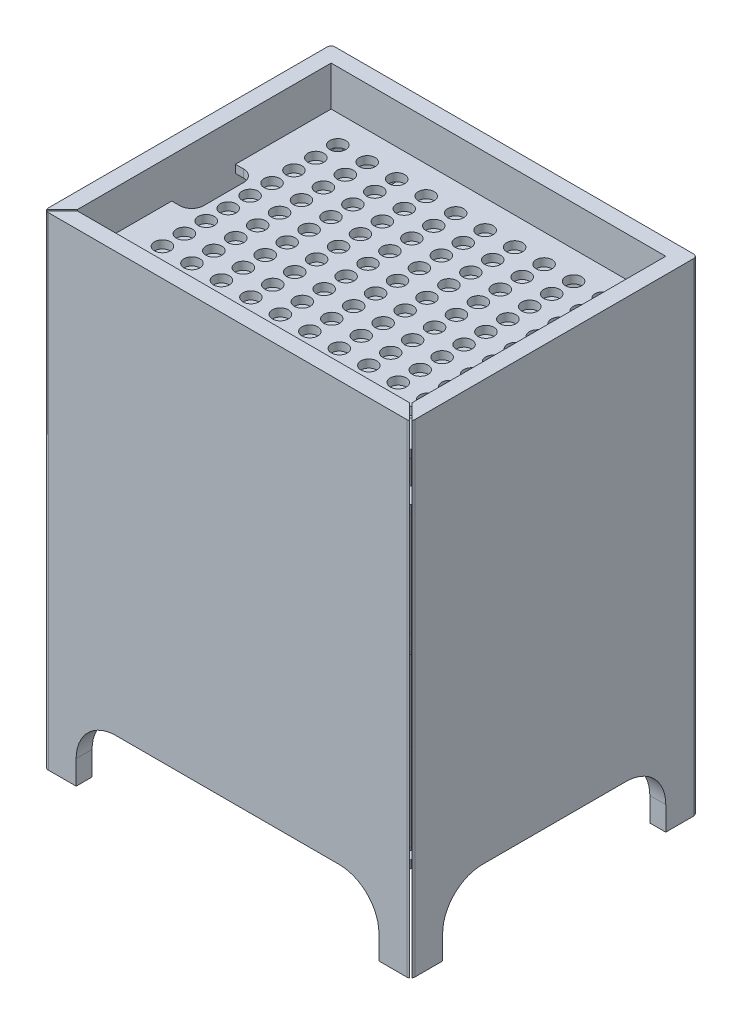
from build123d import *

# Parameters (mm, degrees)
SKETCH2_W                 = 420
SKETCH2_H                 = 320
BOSS_EXTRUDE1_DEPTH       = 10
SKETCH6_W                 = 400
SKETCH6_H                 = 300
BOSS_EXTRUDE4_DEPTH       = 3
SKETCH4_W                 = 400
SKETCH4_H                 = 300
BOSS_EXTRUDE2_DEPTH       = 110
SKETCH5_W                 = 400
SKETCH5_H                 = 300
BOSS_EXTRUDE3_DEPTH       = 110
SKETCH7_W                 = 420
SKETCH7_H                 = 320
SKETCH7_W_2               = 360
SKETCH7_H_2               = 260
BOSS_EXTRUDE5_DEPTH       = 3
SKETCH8_W                 = 420
SKETCH8_H                 = 320
SKETCH8_W_2               = 380
SKETCH8_H_2               = 280
BOSS_EXTRUDE6_DEPTH       = 20
SKETCH9_W                 = 390
SKETCH9_H                 = 290
SKETCH9_R                 = 110
BOSS_EXTRUDE7_DEPTH       = 10
SKETCH10_W                = 420
SKETCH10_H                = 320
SKETCH10_W_2              = 390
SKETCH10_H_2              = 290
BOSS_EXTRUDE8_DEPTH       = 130
SKETCH11_W                = 420
SKETCH11_H                = 320
SKETCH11_R                = 110
BOSS_EXTRUDE9_DEPTH       = 10
SKETCH12_W                = 100
SKETCH12_H                = 15
SKETCH12_W_2              = 15
SKETCH12_H_2              = 100
BOSS_EXTRUDE10_DEPTH      = 50
SKETCH13_W                = 420
SKETCH13_H                = 320
BOSS_EXTRUDE11_DEPTH      = 10
SKETCH14_R                = 10
CUT_EXTRUDE1_DEPTH        = 10
CUT_EXTRUDE2_DEPTH        = 10
BOSS_EXTRUDE12_DEPTH      = 2
BOSS_EXTRUDE14_DEPTH      = 50
BOSS_EXTRUDE14_DEPTH_BACK = 556
SKETCH18_W                = 460
SKETCH18_H                = 360
SKETCH18_W_2              = 420
SKETCH18_H_2              = 320
CUT_EXTRUDE3_DEPTH        = 732.939888242
CUT_EXTRUDE3_DEPTH_BACK   = 50
CUT_EXTRUDE4_DEPTH        = 771.218150916
CUT_EXTRUDE4_DEPTH_BACK   = 50
FILLET1_R                 = 5
CUT_EXTRUDE5_START        = -606
CUT_EXTRUDE5_DEPTH        = 606


with BuildPart() as part:
    # Sketch2 → Boss-Extrude1 (new body)
    with BuildSketch(Plane(origin=(0, 100, 0), x_dir=(1, 0, 0), z_dir=(0, 1, 0))):
        Rectangle(SKETCH2_W, SKETCH2_H)
        with BuildLine():
            Line((180, -105), (180, 105))
            ThreePointArc((180, 105), (172.67766953, 122.67766953), (155, 130))
            Line((155, 130), (-155, 130))
            ThreePointArc((-155, 130), (-172.67766953, 122.67766953), (-180, 105))
            Line((-180, 105), (-180, -105))
            ThreePointArc((-180, -105), (-172.67766953, -122.67766953), (-155, -130))
            Line((-155, -130), (155, -130))
            ThreePointArc((155, -130), (172.67766953, -122.67766953), (180, -105))
        make_face(mode=Mode.SUBTRACT)
    extrude(amount=BOSS_EXTRUDE1_DEPTH)


with BuildPart() as body_2:
    # Sketch6 → Boss-Extrude4 (new body)
    with BuildSketch(Plane(origin=(0, 110, 0), x_dir=(1, 0, 0), z_dir=(0, 1, 0))):
        Rectangle(SKETCH6_W, SKETCH6_H)
    extrude(amount=BOSS_EXTRUDE4_DEPTH)


with BuildPart() as body_3:
    # Sketch4 → Boss-Extrude2 (new body)
    with BuildSketch(Plane(origin=(0, 113, 0), x_dir=(1, 0, 0), z_dir=(0, 1, 0))):
        Rectangle(SKETCH4_W, SKETCH4_H)
    extrude(amount=BOSS_EXTRUDE2_DEPTH)


with BuildPart() as body_4:
    # Sketch5 → Boss-Extrude3 (new body)
    with BuildSketch(Plane(origin=(0, 223, 0), x_dir=(1, 0, 0), z_dir=(0, 1, 0))):
        Rectangle(SKETCH5_W, SKETCH5_H)
    extrude(amount=BOSS_EXTRUDE3_DEPTH)


with BuildPart() as body_5:
    # Sketch7 → Boss-Extrude5 (new body)
    with BuildSketch(Plane(origin=(0, 333, 0), x_dir=(1, 0, 0), z_dir=(0, 1, 0))):
        Rectangle(SKETCH7_W, SKETCH7_H)
        Rectangle(SKETCH7_W_2, SKETCH7_H_2, mode=Mode.SUBTRACT)
    extrude(amount=BOSS_EXTRUDE5_DEPTH)


with BuildPart() as body_6:
    # Sketch8 → Boss-Extrude6 (new body)
    with BuildSketch(Plane(origin=(0, 336, 0), x_dir=(1, 0, 0), z_dir=(0, 1, 0))):
        Rectangle(SKETCH8_W, SKETCH8_H)
        Rectangle(SKETCH8_W_2, SKETCH8_H_2, mode=Mode.SUBTRACT)
    extrude(amount=BOSS_EXTRUDE6_DEPTH)


with BuildPart() as body_7:
    # Sketch9 → Boss-Extrude7 (new body)
    with BuildSketch(Plane(origin=(0, 356, 0), x_dir=(1, 0, 0), z_dir=(0, 1, 0))):
        Rectangle(SKETCH9_W, SKETCH9_H)
        with Locations(Location((0, 0, 0), (0, 0, 270))):
            Circle(SKETCH9_R, mode=Mode.SUBTRACT)
    extrude(amount=BOSS_EXTRUDE7_DEPTH)


with BuildPart() as body_8:
    # Sketch10 → Boss-Extrude8 (new body)
    with BuildSketch(Plane(origin=(0, 356, 0), x_dir=(1, 0, 0), z_dir=(0, 1, 0))):
        Rectangle(SKETCH10_W, SKETCH10_H)
        Rectangle(SKETCH10_W_2, SKETCH10_H_2, mode=Mode.SUBTRACT)
    extrude(amount=BOSS_EXTRUDE8_DEPTH)


with BuildPart() as body_9:
    # Sketch11 → Boss-Extrude9 (new body)
    with BuildSketch(Plane(origin=(0, 486, 0), x_dir=(1, 0, 0), z_dir=(0, 1, 0))):
        Rectangle(SKETCH11_W, SKETCH11_H)
        with Locations(Location((0, 0, 0), (0, 0, 270))):
            Circle(SKETCH11_R, mode=Mode.SUBTRACT)
    extrude(amount=BOSS_EXTRUDE9_DEPTH)


with BuildPart() as body_10:
    # Sketch12 → Boss-Extrude10 (new body)
    with BuildSketch(Plane(origin=(0, 496, 0), x_dir=(1, 0, 0), z_dir=(0, 1, 0))):
        with Locations((-50, 132.5)):
            Rectangle(SKETCH12_W, SKETCH12_H)
        with Locations((50, 132.5)):
            Rectangle(SKETCH12_W, SKETCH12_H)
        with Locations((182.5, 90)):
            Rectangle(SKETCH12_W_2, SKETCH12_H_2)
        with Locations((182.5, -90)):
            Rectangle(SKETCH12_W_2, SKETCH12_H_2)
        with Locations((50, -132.5)):
            Rectangle(SKETCH12_W, SKETCH12_H)
        with Locations((-50, -132.5)):
            Rectangle(SKETCH12_W, SKETCH12_H)
        with Locations((-182.5, -90)):
            Rectangle(SKETCH12_W_2, SKETCH12_H_2)
        with Locations((-182.5, 90)):
            Rectangle(SKETCH12_W_2, SKETCH12_H_2)
    extrude(amount=BOSS_EXTRUDE10_DEPTH)


with BuildPart() as body_11:
    # Sketch13 → Boss-Extrude11 (new body)
    with BuildSketch(Plane(origin=(0, 546, 0), x_dir=(1, 0, 0), z_dir=(0, 1, 0))):
        Rectangle(SKETCH13_W, SKETCH13_H)
    extrude(amount=BOSS_EXTRUDE11_DEPTH)

    # Sketch14 → Cut-Extrude1 (cut)
    with BuildSketch(Plane(origin=(0, 556, 0), x_dir=(1, 0, 0), z_dir=(0, 1, 0))):
        with Locations(Location((-166.666666667, 125, 0), (0, 0, 270))):
            Circle(SKETCH14_R)
        with Locations(Location((-129.666666667, 125, 0), (0, 0, 270))):
            Circle(SKETCH14_R)
        with Locations(Location((-92.666666667, 125, 0), (0, 0, 270))):
            Circle(SKETCH14_R)
        with Locations(Location((-55.666666667, 125, 0), (0, 0, 270))):
            Circle(SKETCH14_R)
        with Locations(Location((-18.666666667, 125, 0), (0, 0, 270))):
            Circle(SKETCH14_R)
        with Locations(Location((18.333333333, 125, 0), (0, 0, 270))):
            Circle(SKETCH14_R)
        with Locations(Location((55.333333333, 125, 0), (0, 0, 270))):
            Circle(SKETCH14_R)
        with Locations(Location((92.333333333, 125, 0), (0, 0, 270))):
            Circle(SKETCH14_R)
        with Locations(Location((129.333333333, 125, 0), (0, 0, 270))):
            Circle(SKETCH14_R)
        with Locations(Location((166.333333333, 125, 0), (0, 0, 270))):
            Circle(SKETCH14_R)
        with Locations(Location((-166.666666667, 97.5, 0), (0, 0, 270))):
            Circle(SKETCH14_R)
        with Locations(Location((-129.666666667, 97.5, 0), (0, 0, 270))):
            Circle(SKETCH14_R)
        with Locations(Location((-92.666666667, 97.5, 0), (0, 0, 270))):
            Circle(SKETCH14_R)
        with Locations(Location((-55.666666667, 97.5, 0), (0, 0, 270))):
            Circle(SKETCH14_R)
        with Locations(Location((-18.666666667, 97.5, 0), (0, 0, 270))):
            Circle(SKETCH14_R)
        with Locations(Location((18.333333333, 97.5, 0), (0, 0, 270))):
            Circle(SKETCH14_R)
        with Locations(Location((55.333333333, 97.5, 0), (0, 0, 270))):
            Circle(SKETCH14_R)
        with Locations(Location((92.333333333, 97.5, 0), (0, 0, 270))):
            Circle(SKETCH14_R)
        with Locations(Location((129.333333333, 97.5, 0), (0, 0, 270))):
            Circle(SKETCH14_R)
        with Locations(Location((166.333333333, 97.5, 0), (0, 0, 270))):
            Circle(SKETCH14_R)
        with Locations(Location((-166.666666667, 70, 0), (0, 0, 270))):
            Circle(SKETCH14_R)
        with Locations(Location((-129.666666667, 70, 0), (0, 0, 270))):
            Circle(SKETCH14_R)
        with Locations(Location((-92.666666667, 70, 0), (0, 0, 270))):
            Circle(SKETCH14_R)
        with Locations(Location((-55.666666667, 70, 0), (0, 0, 270))):
            Circle(SKETCH14_R)
        with Locations(Location((-18.666666667, 70, 0), (0, 0, 270))):
            Circle(SKETCH14_R)
        with Locations(Location((18.333333333, 70, 0), (0, 0, 270))):
            Circle(SKETCH14_R)
        with Locations(Location((55.333333333, 70, 0), (0, 0, 270))):
            Circle(SKETCH14_R)
        with Locations(Location((92.333333333, 70, 0), (0, 0, 270))):
            Circle(SKETCH14_R)
        with Locations(Location((129.333333333, 70, 0), (0, 0, 270))):
            Circle(SKETCH14_R)
        with Locations(Location((166.333333333, 70, 0), (0, 0, 270))):
            Circle(SKETCH14_R)
        with Locations(Location((-166.666666667, 42.5, 0), (0, 0, 270))):
            Circle(SKETCH14_R)
        with Locations(Location((-129.666666667, 42.5, 0), (0, 0, 270))):
            Circle(SKETCH14_R)
        with Locations(Location((-92.666666667, 42.5, 0), (0, 0, 270))):
            Circle(SKETCH14_R)
        with Locations(Location((-55.666666667, 42.5, 0), (0, 0, 270))):
            Circle(SKETCH14_R)
        with Locations(Location((-18.666666667, 42.5, 0), (0, 0, 270))):
            Circle(SKETCH14_R)
        with Locations(Location((18.333333333, 42.5, 0), (0, 0, 270))):
            Circle(SKETCH14_R)
        with Locations(Location((55.333333333, 42.5, 0), (0, 0, 270))):
            Circle(SKETCH14_R)
        with Locations(Location((92.333333333, 42.5, 0), (0, 0, 270))):
            Circle(SKETCH14_R)
        with Locations(Location((129.333333333, 42.5, 0), (0, 0, 270))):
            Circle(SKETCH14_R)
        with Locations(Location((166.333333333, 42.5, 0), (0, 0, 270))):
            Circle(SKETCH14_R)
        with Locations(Location((-166.666666667, 15, 0), (0, 0, 270))):
            Circle(SKETCH14_R)
        with Locations(Location((-129.666666667, 15, 0), (0, 0, 270))):
            Circle(SKETCH14_R)
        with Locations(Location((-92.666666667, 15, 0), (0, 0, 270))):
            Circle(SKETCH14_R)
        with Locations(Location((-55.666666667, 15, 0), (0, 0, 270))):
            Circle(SKETCH14_R)
        with Locations(Location((-18.666666667, 15, 0), (0, 0, 270))):
            Circle(SKETCH14_R)
        with Locations(Location((18.333333333, 15, 0), (0, 0, 270))):
            Circle(SKETCH14_R)
        with Locations(Location((55.333333333, 15, 0), (0, 0, 270))):
            Circle(SKETCH14_R)
        with Locations(Location((92.333333333, 15, 0), (0, 0, 270))):
            Circle(SKETCH14_R)
        with Locations(Location((129.333333333, 15, 0), (0, 0, 270))):
            Circle(SKETCH14_R)
        with Locations(Location((166.333333333, 15, 0), (0, 0, 270))):
            Circle(SKETCH14_R)
        with Locations(Location((-166.666666667, -12.5, 0), (0, 0, 270))):
            Circle(SKETCH14_R)
        with Locations(Location((-129.666666667, -12.5, 0), (0, 0, 270))):
            Circle(SKETCH14_R)
        with Locations(Location((-92.666666667, -12.5, 0), (0, 0, 270))):
            Circle(SKETCH14_R)
        with Locations(Location((-55.666666667, -12.5, 0), (0, 0, 270))):
            Circle(SKETCH14_R)
        with Locations(Location((-18.666666667, -12.5, 0), (0, 0, 270))):
            Circle(SKETCH14_R)
        with Locations(Location((18.333333333, -12.5, 0), (0, 0, 270))):
            Circle(SKETCH14_R)
        with Locations(Location((55.333333333, -12.5, 0), (0, 0, 270))):
            Circle(SKETCH14_R)
        with Locations(Location((92.333333333, -12.5, 0), (0, 0, 270))):
            Circle(SKETCH14_R)
        with Locations(Location((129.333333333, -12.5, 0), (0, 0, 270))):
            Circle(SKETCH14_R)
        with Locations(Location((166.333333333, -12.5, 0), (0, 0, 270))):
            Circle(SKETCH14_R)
        with Locations(Location((-166.666666667, -40, 0), (0, 0, 270))):
            Circle(SKETCH14_R)
        with Locations(Location((-129.666666667, -40, 0), (0, 0, 270))):
            Circle(SKETCH14_R)
        with Locations(Location((-92.666666667, -40, 0), (0, 0, 270))):
            Circle(SKETCH14_R)
        with Locations(Location((-55.666666667, -40, 0), (0, 0, 270))):
            Circle(SKETCH14_R)
        with Locations(Location((-18.666666667, -40, 0), (0, 0, 270))):
            Circle(SKETCH14_R)
        with Locations(Location((18.333333333, -40, 0), (0, 0, 270))):
            Circle(SKETCH14_R)
        with Locations(Location((55.333333333, -40, 0), (0, 0, 270))):
            Circle(SKETCH14_R)
        with Locations(Location((92.333333333, -40, 0), (0, 0, 270))):
            Circle(SKETCH14_R)
        with Locations(Location((129.333333333, -40, 0), (0, 0, 270))):
            Circle(SKETCH14_R)
        with Locations(Location((166.333333333, -40, 0), (0, 0, 270))):
            Circle(SKETCH14_R)
        with Locations(Location((-166.666666667, -67.5, 0), (0, 0, 270))):
            Circle(SKETCH14_R)
        with Locations(Location((-129.666666667, -67.5, 0), (0, 0, 270))):
            Circle(SKETCH14_R)
        with Locations(Location((-92.666666667, -67.5, 0), (0, 0, 270))):
            Circle(SKETCH14_R)
        with Locations(Location((-55.666666667, -67.5, 0), (0, 0, 270))):
            Circle(SKETCH14_R)
        with Locations(Location((-18.666666667, -67.5, 0), (0, 0, 270))):
            Circle(SKETCH14_R)
        with Locations(Location((18.333333333, -67.5, 0), (0, 0, 270))):
            Circle(SKETCH14_R)
        with Locations(Location((55.333333333, -67.5, 0), (0, 0, 270))):
            Circle(SKETCH14_R)
        with Locations(Location((92.333333333, -67.5, 0), (0, 0, 270))):
            Circle(SKETCH14_R)
        with Locations(Location((129.333333333, -67.5, 0), (0, 0, 270))):
            Circle(SKETCH14_R)
        with Locations(Location((166.333333333, -67.5, 0), (0, 0, 270))):
            Circle(SKETCH14_R)
        with Locations(Location((-166.666666667, -95, 0), (0, 0, 270))):
            Circle(SKETCH14_R)
        with Locations(Location((-129.666666667, -95, 0), (0, 0, 270))):
            Circle(SKETCH14_R)
        with Locations(Location((-92.666666667, -95, 0), (0, 0, 270))):
            Circle(SKETCH14_R)
        with Locations(Location((-55.666666667, -95, 0), (0, 0, 270))):
            Circle(SKETCH14_R)
        with Locations(Location((-18.666666667, -95, 0), (0, 0, 270))):
            Circle(SKETCH14_R)
        with Locations(Location((18.333333333, -95, 0), (0, 0, 270))):
            Circle(SKETCH14_R)
        with Locations(Location((55.333333333, -95, 0), (0, 0, 270))):
            Circle(SKETCH14_R)
        with Locations(Location((92.333333333, -95, 0), (0, 0, 270))):
            Circle(SKETCH14_R)
        with Locations(Location((129.333333333, -95, 0), (0, 0, 270))):
            Circle(SKETCH14_R)
        with Locations(Location((166.333333333, -95, 0), (0, 0, 270))):
            Circle(SKETCH14_R)
        with Locations(Location((-166.666666667, -122.5, 0), (0, 0, 270))):
            Circle(SKETCH14_R)
        with Locations(Location((-129.666666667, -122.5, 0), (0, 0, 270))):
            Circle(SKETCH14_R)
        with Locations(Location((-92.666666667, -122.5, 0), (0, 0, 270))):
            Circle(SKETCH14_R)
        with Locations(Location((-55.666666667, -122.5, 0), (0, 0, 270))):
            Circle(SKETCH14_R)
        with Locations(Location((-18.666666667, -122.5, 0), (0, 0, 270))):
            Circle(SKETCH14_R)
        with Locations(Location((18.333333333, -122.5, 0), (0, 0, 270))):
            Circle(SKETCH14_R)
        with Locations(Location((55.333333333, -122.5, 0), (0, 0, 270))):
            Circle(SKETCH14_R)
        with Locations(Location((92.333333333, -122.5, 0), (0, 0, 270))):
            Circle(SKETCH14_R)
        with Locations(Location((129.333333333, -122.5, 0), (0, 0, 270))):
            Circle(SKETCH14_R)
        with Locations(Location((166.333333333, -122.5, 0), (0, 0, 270))):
            Circle(SKETCH14_R)
    extrude(amount=-CUT_EXTRUDE1_DEPTH, mode=Mode.SUBTRACT)

    # Sketch15 → Cut-Extrude2 (cut)
    with BuildSketch(Plane(origin=(0, 556, 0), x_dir=(1, 0, 0), z_dir=(0, 1, 0))):
        with BuildLine():
            Line((210, 40), (200, 40))
            ThreePointArc((200, 40), (189.393398282, 35.606601718), (185, 25))
            Line((185, 25), (185, -25))
            ThreePointArc((185, -25), (189.393398282, -35.606601718), (200, -40))
            Line((200, -40), (210, -40))
            Line((210, -40), (210, 40))
        make_face()
        with BuildLine():
            Line((-185, 25), (-185, -25))
            ThreePointArc((-185, -25), (-189.393398282, -35.606601718), (-200, -40))
            Line((-200, -40), (-210, -40))
            Line((-210, -40), (-210, 40))
            Line((-210, 40), (-200, 40))
            ThreePointArc((-200, 40), (-189.393398282, 35.606601718), (-185, 25))
        make_face()
    extrude(amount=-CUT_EXTRUDE2_DEPTH, mode=Mode.SUBTRACT)


with BuildPart() as body_12:
    # Sketch16 → Boss-Extrude12 (new body)
    with BuildSketch(Plane.XZ.offset(-546)):
        Polygon((176.333333333, -125), (176.333333333, 125), (100, 125), (-176.349125032, 125), (-176.666666667, -125), align=None)
    extrude(amount=BOSS_EXTRUDE12_DEPTH)


with BuildPart() as body_13:
    # Sketch18 → Boss-Extrude14 (new, two sides: drawn at the far end of the back side and taken through both)
    with BuildSketch(Plane(origin=(0, 556, 0), x_dir=(1, 0, 0), z_dir=(0, 1, 0)).offset(-BOSS_EXTRUDE14_DEPTH_BACK)):
        Rectangle(SKETCH18_W, SKETCH18_H)
        Rectangle(SKETCH18_W_2, SKETCH18_H_2, mode=Mode.SUBTRACT)
    extrude(amount=BOSS_EXTRUDE14_DEPTH + BOSS_EXTRUDE14_DEPTH_BACK)

    # Sketch19 → Cut-Extrude3 (cut, two sides: drawn at the far end of the back side and taken through both)
    with BuildSketch(Plane(origin=(0, 0, 160), x_dir=(-1, 0, 0), z_dir=(0, 0, -1)).offset(-CUT_EXTRUDE3_DEPTH_BACK)):
        with BuildLine():
            Line((-190, 30), (-190, 0))
            Line((-190, 0), (190, 0))
            Line((190, 0), (190, 30))
            ThreePointArc((190, 30), (175.355339059, 65.355339059), (140, 80))
            Line((140, 80), (-140, 80))
            ThreePointArc((-140, 80), (-175.355339059, 65.355339059), (-190, 30))
        make_face()
    extrude(amount=CUT_EXTRUDE3_DEPTH + CUT_EXTRUDE3_DEPTH_BACK, mode=Mode.SUBTRACT)

    # Sketch20 → Cut-Extrude4 (cut, two sides: drawn at the far end of the back side and taken through both)
    with BuildSketch(Plane(origin=(-210, 0, 0), x_dir=(0, 0, -1), z_dir=(1, 0, 0)).offset(-CUT_EXTRUDE4_DEPTH_BACK)):
        with BuildLine():
            Line((-140, 0), (-140, 30))
            ThreePointArc((-140, 30), (-125.355339059, 65.355339059), (-90, 80))
            Line((-90, 80), (90, 80))
            ThreePointArc((90, 80), (125.355339059, 65.355339059), (140, 30))
            Line((140, 30), (140, 0))
            Line((140, 0), (-140, 0))
        make_face()
    extrude(amount=CUT_EXTRUDE4_DEPTH + CUT_EXTRUDE4_DEPTH_BACK, mode=Mode.SUBTRACT)

    # Fillet1
    fillet1_edges = [body_13.edges().sort_by_distance(p)[0] for p in [
        (-230, 303, -180),
        (230, 303, -180),
        (230, 303, 180),
        (-230, 303, 180),
    ]]
    fillet(fillet1_edges, radius=FILLET1_R)

    # Sketch21 → Cut-Extrude5 (cut)
    with BuildSketch(Plane(origin=(0, 606, 0), x_dir=(1, 0, 0), z_dir=(0, 1, 0)).offset(CUT_EXTRUDE5_START)):
        Polygon((207.843268283, -159.257481845), (227.828427125, -179.242640687), (229.242640687, -177.828427125), (209.331843472, -157.91762991), align=None)
        Polygon((-209.923882432, -158.50966887), (-229.242640687, -177.828427125), (-227.828427125, -179.242640687), (-208.23543521, -159.649648772), align=None)
    extrude(amount=CUT_EXTRUDE5_DEPTH, mode=Mode.SUBTRACT)


with BuildPart() as cut_extrude5_piece_1:
    # of the separate pieces the step leaves, piece 1, a body of its own (cut_extrude5_pieces)
    add(body_13.part.solids().sort_by_distance((-229.171208396, 0, 177.756994834))[0])


with BuildPart() as cut_extrude5_piece_2:
    # of the separate pieces the step leaves, piece 2, a body of its own (cut_extrude5_pieces)
    add(body_13.part.solids().sort_by_distance((-225, 0, 180))[0])


solid = Compound([part.part, body_2.part, body_3.part, body_4.part, body_5.part, body_6.part, body_7.part, body_8.part, body_9.part, body_10.part, body_11.part, body_12.part, cut_extrude5_piece_1.part, cut_extrude5_piece_2.part])
